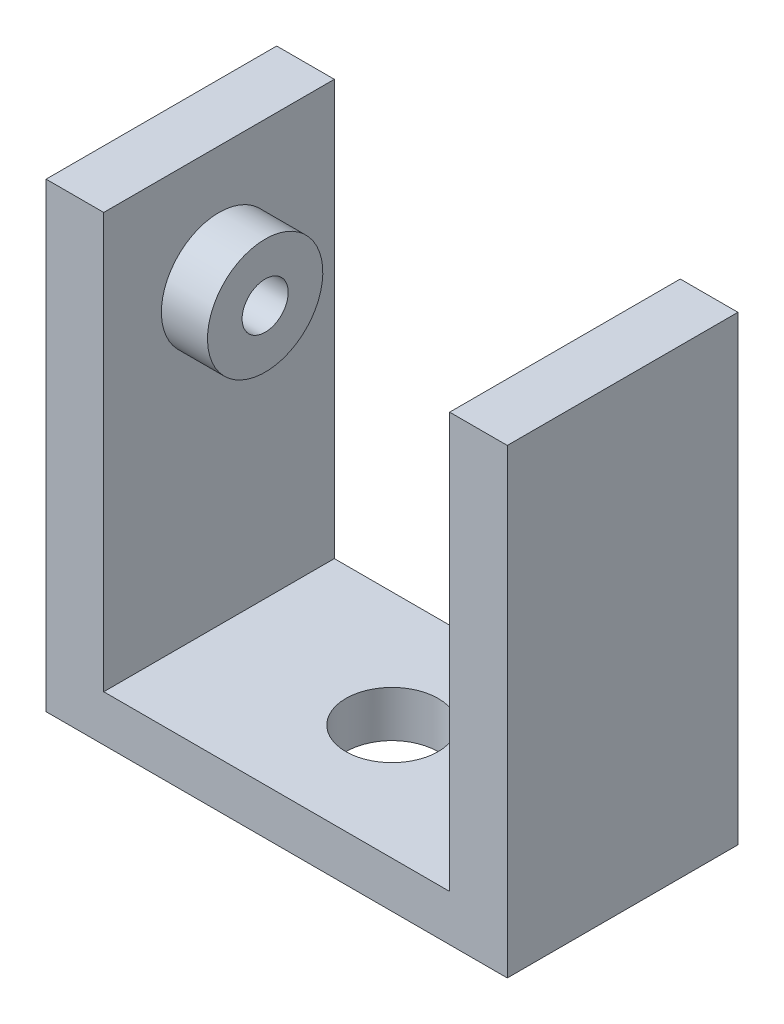
from build123d import *

# Parameters (mm, degrees)
SKETCH_1_W               = 40
SKETCH_1_H               = 20
EXTRUDE_1_DEPTH          = 40
CUT_EXTRUDE_1_DEPTH      = 49.989794856
CUT_EXTRUDE_1_DEPTH_BACK = 49.989794856
SKETCH_4_R               = 4
CUT_EXTRUDE_3_DEPTH      = 46.82575695
SKETCH_5_R               = 5
SKETCH_5_R_2             = 2
EXTRUDE_2_DEPTH          = 4


with BuildPart() as part:
    # 草图1 → 凸台-拉伸1 (new body)
    with BuildSketch(Plane(origin=(0, 0, 0), x_dir=(1, 0, 0), z_dir=(0, 1, 0))):
        Rectangle(SKETCH_1_W, SKETCH_1_H)
    extrude(amount=EXTRUDE_1_DEPTH)

    # 草图2 → 切除-拉伸1 (cut, two sides: drawn at the far end of the back side and taken through both)
    with BuildSketch(Plane.XY.offset(10).offset(-CUT_EXTRUDE_1_DEPTH_BACK)):
        Polygon((-15, 156.301458127), (-15, 40), (-15, 4), (15, 4), (15, 40), (15, 156.301458127), (15, 388.904374382), (-15, 388.904374382), align=None)
    extrude(amount=CUT_EXTRUDE_1_DEPTH + CUT_EXTRUDE_1_DEPTH_BACK, mode=Mode.SUBTRACT)

    # 草图4 → 切除-拉伸3 (cut, through all)
    with BuildSketch(Plane.XZ):
        with Locations(Location((0, 0, 0), (0, 0, 270))):
            Circle(SKETCH_4_R)
    extrude(amount=-CUT_EXTRUDE_3_DEPTH, mode=Mode.SUBTRACT)

    # 草图5 → 凸台-拉伸2 (add)
    with BuildSketch(Plane(origin=(-15, 0, 0), x_dir=(0, 0, -1), z_dir=(1, 0, 0))):
        with Locations(Location((0, 30, 0), (0, 0, 90))):
            Circle(SKETCH_5_R)
        with Locations(Location((0, 30, 0), (0, 0, 90))):
            Circle(SKETCH_5_R_2, mode=Mode.SUBTRACT)
    extrude_2 = extrude(amount=EXTRUDE_2_DEPTH)

    # 镜向1: 凸台-拉伸2 across plane
    add(extrude_2.mirror(Plane(origin=(0, 0, 0), x_dir=(0, 0, 1), z_dir=(1, 0, 0))))


solid = part.part
